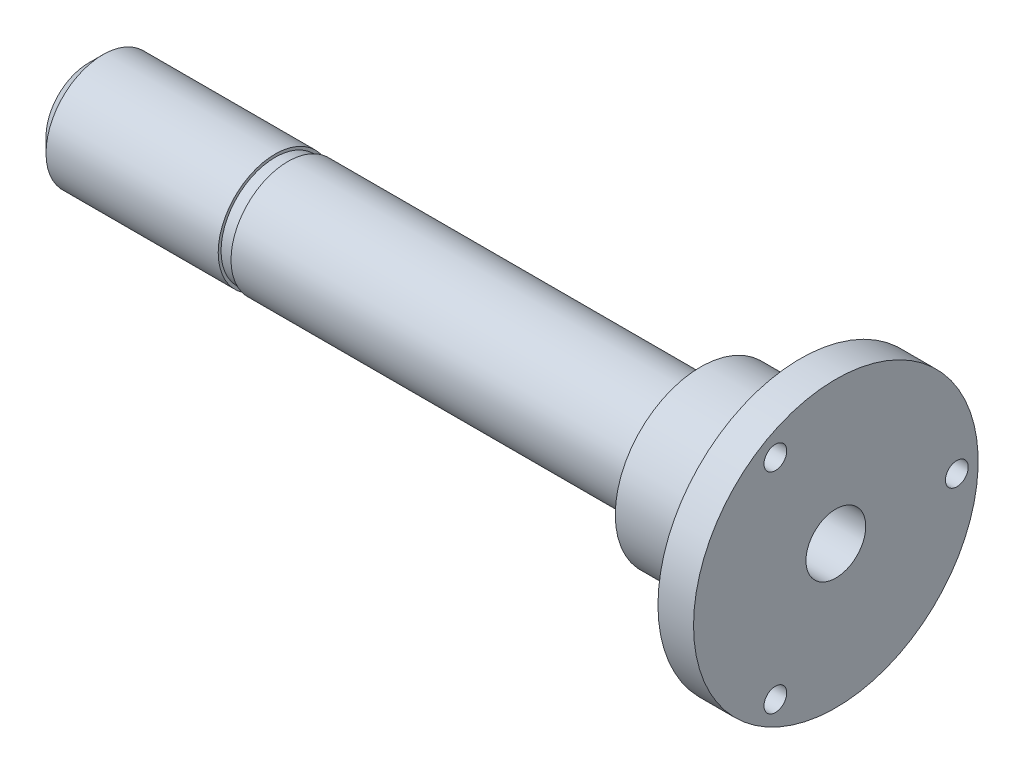
from build123d import *

# Parameters (mm, degrees)
M2X0_4_TAPPED_HOLE1_D = 1.6


with BuildPart() as part:
    # Sketch1 → Revolve1 (revolve)
    with BuildSketch(Plane(origin=(0, 0, 0), x_dir=(-1, 0, 0), z_dir=(0, 0, -1)), mode=Mode.PRIVATE) as revolve1_sk:
        with BuildLine():
            Line((50, 2.1), (50, 3))
            add(Edge.make_bspline(
                [(49, 4), (49.333333333, 3.666666667), (49.666666667, 3.333333333), (50, 3)],
                knots=[0, 0, 0, 0, 1, 1, 1, 1], degree=3))
            Line((49, 4), (36.9, 4))
            Line((36.9, 4), (36.9, 3.8))
            Line((36.9, 3.8), (36, 3.8))
            Line((36, 3.8), (36, 4))
            Line((36, 4), (7.2, 4))
            ThreePointArc((7.2, 4), (7.058578644, 4.058578644), (7, 4.2))
            Line((7, 4.2), (7, 6))
            Line((7, 6), (0, 6))
            Line((0, 6), (0, 10))
            Line((0, 10), (-2.5, 10))
            Line((-2.5, 10), (-2.5, 2.1))
            Line((-2.5, 2.1), (50, 2.1))
        make_face()
    revolve(revolve1_sk.sketch.rotate(Axis((0, 0, 0), (-1, 0, 0)), 270), axis=Axis((0, 0, 0), (-1, 0, 0)))

    # M2x0.4 Tapped Hole1 (through all)
    with Locations(Plane(origin=(2.5, 0, 0), x_dir=(0, 0, -1), z_dir=(1, 0, 0))):
        with Locations((8.5, 0), (-4.25, 7.361215932), (-4.25, -7.361215932)):
            Hole(M2X0_4_TAPPED_HOLE1_D / 2)


solid = part.part
